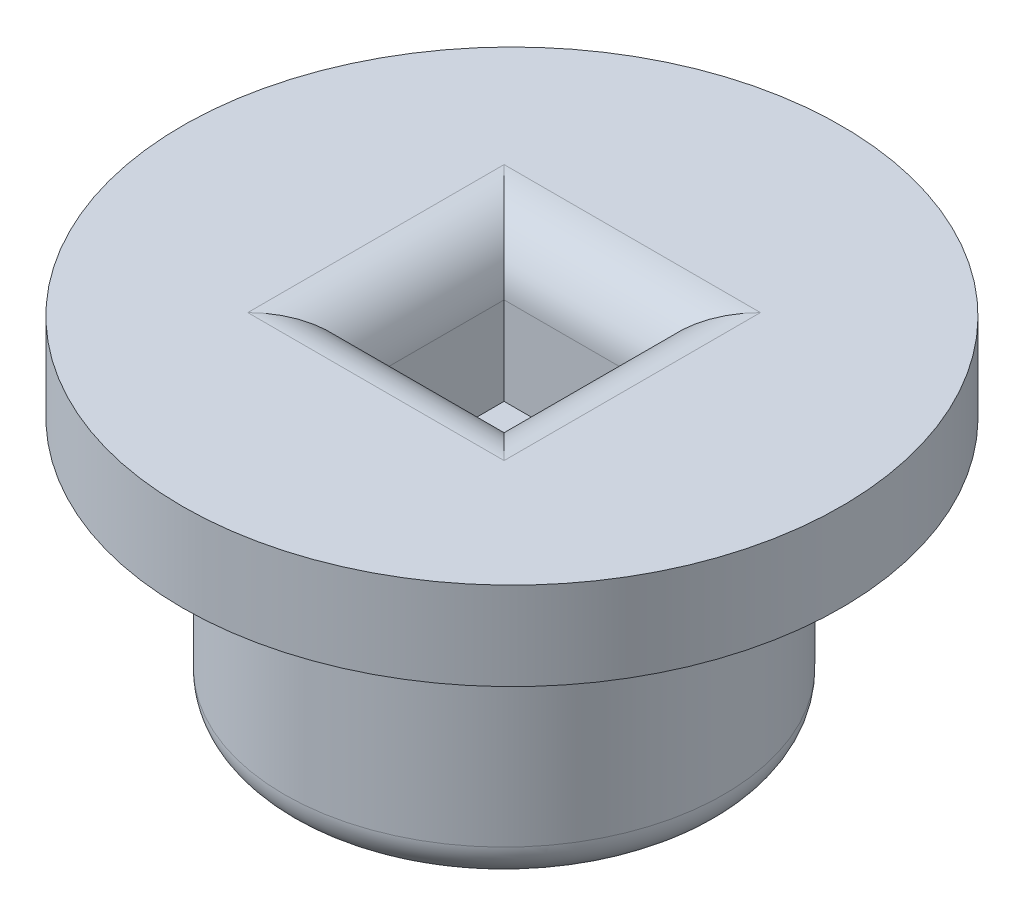
from build123d import *

# Parameters (mm, degrees)
SKETCH_1_R          = 3
EXTRUDE_1_DEPTH     = 3.5
SKETCH_2_R          = 4.5
EXTRUDE_2_DEPTH     = 1.2
SKETCH_4_W          = 1.9
SKETCH_4_H          = 1.9
CUT_EXTRUDE_1_DEPTH = 2
FILLET_1_R          = 0.5
FILLET_2_R          = 0.8


with BuildPart() as part:
    # 草图1 → 凸台-拉伸1 (new body)
    with BuildSketch(Plane(origin=(0, 0, 0), x_dir=(1, 0, 0), z_dir=(0, 1, 0))):
        with Locations(Location((0, 0, 0), (0, 0, 270))):
            Circle(SKETCH_1_R)
    extrude(amount=EXTRUDE_1_DEPTH)

    # 草图2 → 凸台-拉伸2 (add)
    with BuildSketch(Plane(origin=(0, 3.5, 0), x_dir=(1, 0, 0), z_dir=(0, 1, 0))):
        with Locations(Location((0.094879954, 0.012027373, 0), (0, 0, 270))):
            Circle(SKETCH_2_R)
    extrude(amount=EXTRUDE_2_DEPTH)

    # 草图4 → 切除-拉伸1 (cut)
    with BuildSketch(Plane(origin=(0, 4.7, 0), x_dir=(1, 0, 0), z_dir=(0, 1, 0))):
        Rectangle(SKETCH_4_W, SKETCH_4_H)
    extrude(amount=-CUT_EXTRUDE_1_DEPTH, mode=Mode.SUBTRACT)

    # 圆角1
    fillet_1_edges = [part.edges().sort_by_distance(p)[0] for p in [
        (0, 0, -3),
    ]]
    fillet(fillet_1_edges, radius=FILLET_1_R)

    # 圆角2
    fillet_2_edges = [part.edges().sort_by_distance(p)[0] for p in [
        (-0.95, 4.7, 0),
        (0, 4.7, 0.95),
        (0.95, 4.7, 0),
        (0, 4.7, -0.95),
    ]]
    fillet(fillet_2_edges, radius=FILLET_2_R)


solid = part.part
